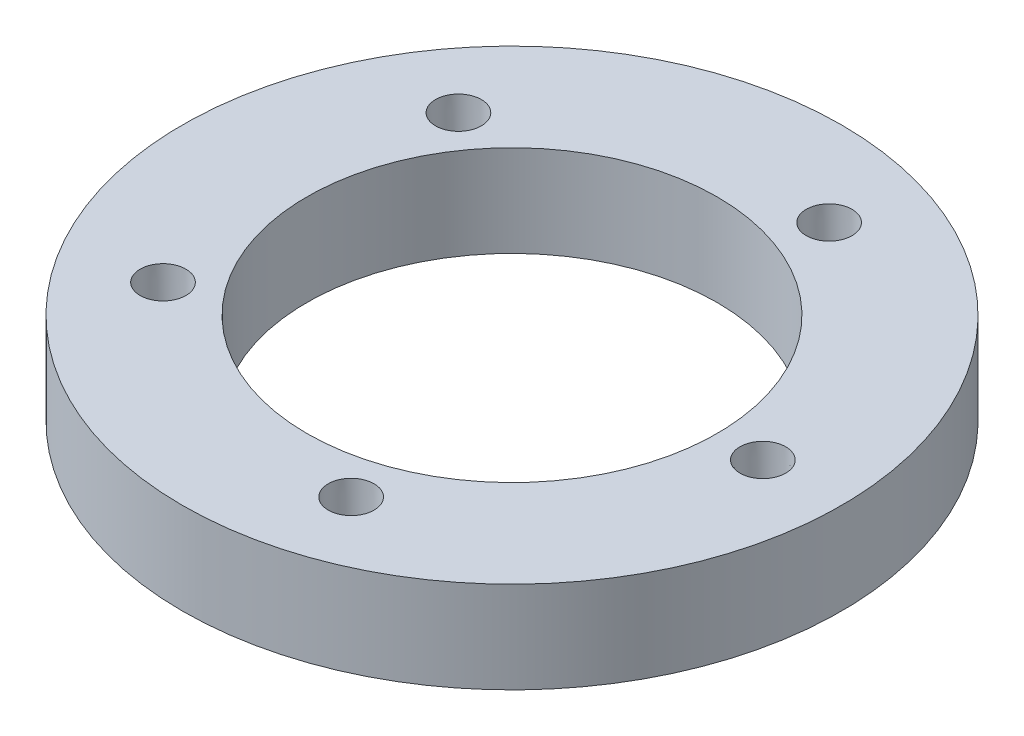
from build123d import *

# Parameters (mm, degrees)
SKETCH1_R                    = 16.2
SKETCH1_R_2                  = 11.2
BOSS_EXTRUDE2_DEPTH          = 5
SKETCH2_R                    = 1.25
CUT_EXTRUDE1_DEPTH           = 5
CUT_EXTRUDE1_DRAFT           = -2
CUT_EXTRUDE1_PROFILE_2_DEPTH = 5
CUT_EXTRUDE1_PROFILE_2_DRAFT = -2
CUT_EXTRUDE1_PROFILE_3_DEPTH = 5
CUT_EXTRUDE1_PROFILE_3_DRAFT = -2
CUT_EXTRUDE1_PROFILE_4_DEPTH = 5
CUT_EXTRUDE1_PROFILE_4_DRAFT = -2
CUT_EXTRUDE1_PROFILE_5_DEPTH = 5
CUT_EXTRUDE1_PROFILE_5_DRAFT = -2
SKETCH3_R                    = 18
SKETCH3_R_2                  = 16
BOSS_EXTRUDE4_DEPTH          = 5


with BuildPart() as part:
    # Sketch1 → Boss-Extrude2 (new body)
    with BuildSketch(Plane(origin=(0, 0, 0), x_dir=(1, 0, 0), z_dir=(0, 1, 0))):
        with Locations(Location((0, 0, 0), (0, 0, 270))):
            Circle(SKETCH1_R)
        with Locations(Location((0, 0, 0), (0, 0, 270))):
            Circle(SKETCH1_R_2, mode=Mode.SUBTRACT)
    extrude(amount=BOSS_EXTRUDE2_DEPTH)


with BuildPart() as cut_extrude1_tool:
    # Sketch2 → Cut-Extrude1 (with draft: the straight prism first)
    with BuildSketch(Plane(origin=(0, 5, 0), x_dir=(1, 0, 0), z_dir=(0, 1, 0))):
        with Locations((-11.039322132, 8.113160104)):
            Circle(SKETCH2_R)
    extrude(amount=-CUT_EXTRUDE1_DEPTH)
    # Cut-Extrude1: the draft: its side faces are tilted about the plane it starts from
    cut_extrude1_sides = [cut_extrude1_tool.faces().sort_by_distance(p)[0] for p in [
        (-12.289322132, 2.5, -8.113160104),
    ]]
    draft(cut_extrude1_sides, Plane(origin=(0, 5, 0), x_dir=(1, 0, 0), z_dir=(0, 1, 0)), CUT_EXTRUDE1_DRAFT)


with BuildPart() as part_1:
    add(part.part)

    # Cut-Extrude1: cut by cut_extrude1_tool
    add(cut_extrude1_tool.part, mode=Mode.SUBTRACT)


with BuildPart() as cut_extrude1_profile_2_tool:
    # Sketch2 → Cut-Extrude1 profile 2 (with draft: the straight prism first)
    with BuildSketch(Plane(origin=(0, 5, 0), x_dir=(1, 0, 0), z_dir=(0, 1, 0))):
        with Locations((-11.083327892, -7.977724299)):
            Circle(SKETCH2_R)
    extrude(amount=-CUT_EXTRUDE1_PROFILE_2_DEPTH)
    # Cut-Extrude1 profile 2: the draft: its side faces are tilted about the plane it starts from
    cut_extrude1_profile_2_sides = [cut_extrude1_profile_2_tool.faces().sort_by_distance(p)[0] for p in [
        (-12.333327892, 2.5, 7.977724299),
    ]]
    draft(cut_extrude1_profile_2_sides, Plane(origin=(0, 5, 0), x_dir=(1, 0, 0), z_dir=(0, 1, 0)), CUT_EXTRUDE1_PROFILE_2_DRAFT)


with BuildPart() as part_2:
    add(part_1.part)

    # Cut-Extrude1 profile 2: cut by cut_extrude1_profile_2_tool
    add(cut_extrude1_profile_2_tool.part, mode=Mode.SUBTRACT)


with BuildPart() as cut_extrude1_profile_3_tool:
    # Sketch2 → Cut-Extrude1 profile 3 (with draft: the straight prism first)
    with BuildSketch(Plane(origin=(0, 5, 0), x_dir=(1, 0, 0), z_dir=(0, 1, 0))):
        with Locations((4.206414044, -12.991932999)):
            Circle(SKETCH2_R)
    extrude(amount=-CUT_EXTRUDE1_PROFILE_3_DEPTH)
    # Cut-Extrude1 profile 3: the draft: its side faces are tilted about the plane it starts from
    cut_extrude1_profile_3_sides = [cut_extrude1_profile_3_tool.faces().sort_by_distance(p)[0] for p in [
        (2.956414044, 2.5, 12.991932999),
    ]]
    draft(cut_extrude1_profile_3_sides, Plane(origin=(0, 5, 0), x_dir=(1, 0, 0), z_dir=(0, 1, 0)), CUT_EXTRUDE1_PROFILE_3_DRAFT)


with BuildPart() as part_3:
    add(part_2.part)

    # Cut-Extrude1 profile 3: cut by cut_extrude1_profile_3_tool
    add(cut_extrude1_profile_3_tool.part, mode=Mode.SUBTRACT)


with BuildPart() as cut_extrude1_profile_4_tool:
    # Sketch2 → Cut-Extrude1 profile 4 (with draft: the straight prism first)
    with BuildSketch(Plane(origin=(0, 5, 0), x_dir=(1, 0, 0), z_dir=(0, 1, 0))):
        with Locations((13.7, 0)):
            Circle(SKETCH2_R)
    extrude(amount=-CUT_EXTRUDE1_PROFILE_4_DEPTH)
    # Cut-Extrude1 profile 4: the draft: its side faces are tilted about the plane it starts from
    cut_extrude1_profile_4_sides = [cut_extrude1_profile_4_tool.faces().sort_by_distance(p)[0] for p in [
        (12.45, 2.5, 0),
    ]]
    draft(cut_extrude1_profile_4_sides, Plane(origin=(0, 5, 0), x_dir=(1, 0, 0), z_dir=(0, 1, 0)), CUT_EXTRUDE1_PROFILE_4_DRAFT)


with BuildPart() as part_4:
    add(part_3.part)

    # Cut-Extrude1 profile 4: cut by cut_extrude1_profile_4_tool
    add(cut_extrude1_profile_4_tool.part, mode=Mode.SUBTRACT)


with BuildPart() as cut_extrude1_profile_5_tool:
    # Sketch2 → Cut-Extrude1 profile 5 (with draft: the straight prism first)
    with BuildSketch(Plane(origin=(0, 5, 0), x_dir=(1, 0, 0), z_dir=(0, 1, 0))):
        with Locations((4.27761686, 13.043664873)):
            Circle(SKETCH2_R)
    extrude(amount=-CUT_EXTRUDE1_PROFILE_5_DEPTH)
    # Cut-Extrude1 profile 5: the draft: its side faces are tilted about the plane it starts from
    cut_extrude1_profile_5_sides = [cut_extrude1_profile_5_tool.faces().sort_by_distance(p)[0] for p in [
        (3.02761686, 2.5, -13.043664873),
    ]]
    draft(cut_extrude1_profile_5_sides, Plane(origin=(0, 5, 0), x_dir=(1, 0, 0), z_dir=(0, 1, 0)), CUT_EXTRUDE1_PROFILE_5_DRAFT)


with BuildPart() as part_5:
    add(part_4.part)

    # Cut-Extrude1 profile 5: cut by cut_extrude1_profile_5_tool
    add(cut_extrude1_profile_5_tool.part, mode=Mode.SUBTRACT)

    # Sketch3 → Boss-Extrude4 (add)
    with BuildSketch(Plane(origin=(0, 5, 0), x_dir=(1, 0, 0), z_dir=(0, 1, 0))):
        with Locations(Location((0, 0, 0), (0, 0, 270))):
            Circle(SKETCH3_R)
        Circle(SKETCH3_R_2, mode=Mode.SUBTRACT)
    extrude(amount=-BOSS_EXTRUDE4_DEPTH)


solid = part_5.part
